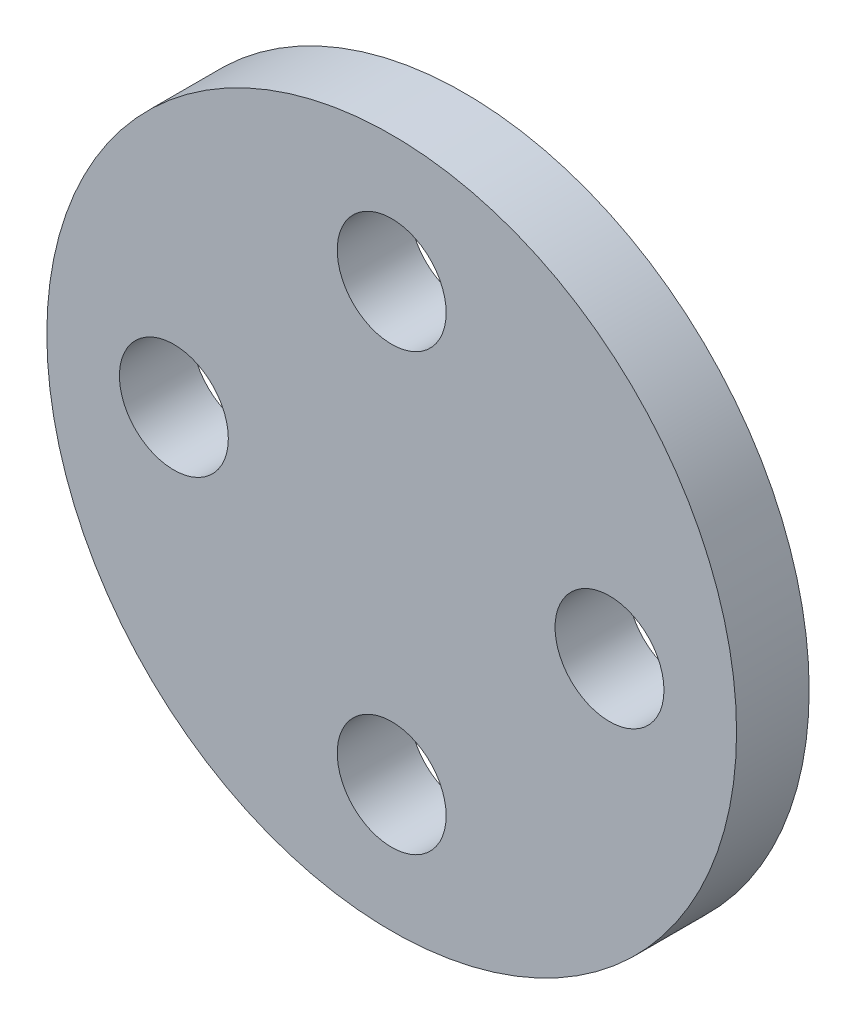
from build123d import *

# Parameters (mm, degrees)
SKETCH1_R           = 15.08125
SKETCH1_R_2         = 2.38125
BOSS_EXTRUDE1_DEPTH = 3.175


with BuildPart() as part:
    # Sketch1 → Boss-Extrude1 (new body)
    with BuildSketch(Plane.XY):
        Circle(SKETCH1_R)
        with Locations((0, 9.525)):
            Circle(SKETCH1_R_2, mode=Mode.SUBTRACT)
        with Locations((9.525, 0)):
            Circle(SKETCH1_R_2, mode=Mode.SUBTRACT)
        with Locations((0, -9.525)):
            Circle(SKETCH1_R_2, mode=Mode.SUBTRACT)
        with Locations((-9.525, 0)):
            Circle(SKETCH1_R_2, mode=Mode.SUBTRACT)
    extrude(amount=BOSS_EXTRUDE1_DEPTH)


solid = part.part
